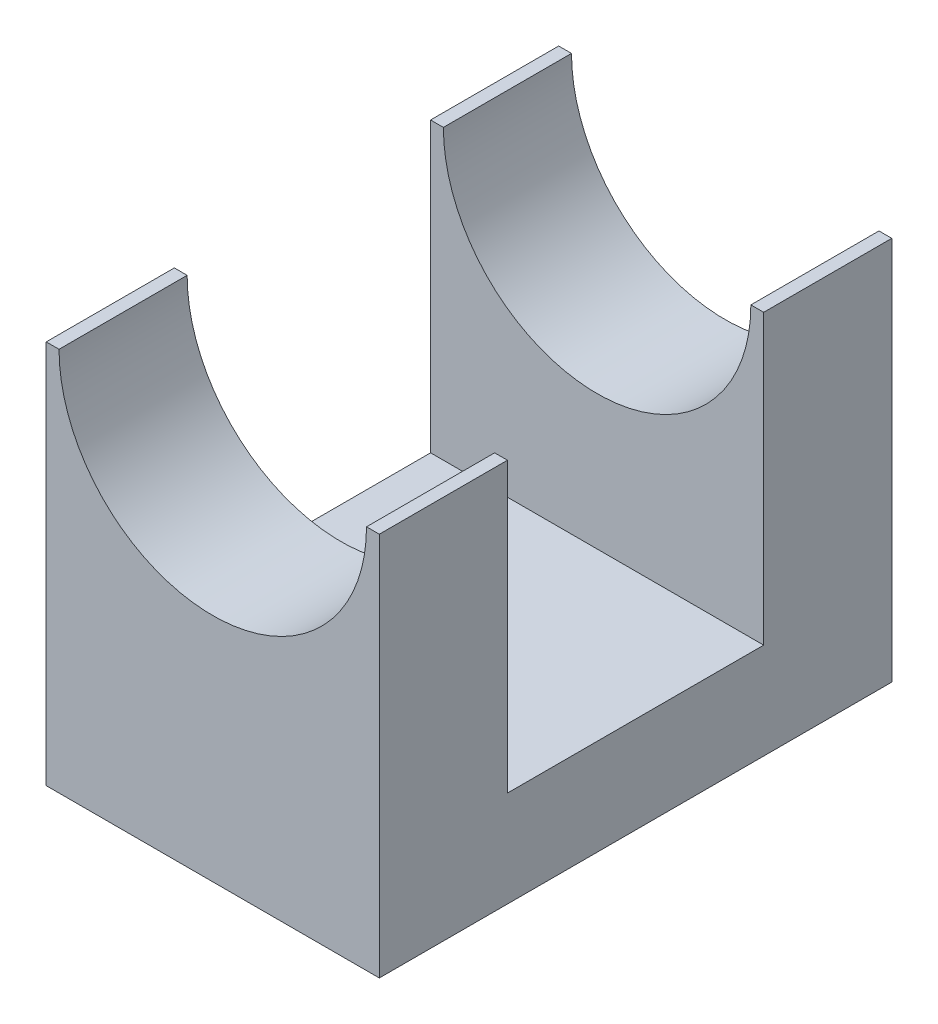
from build123d import *

# Parameters (mm, degrees)
BOSS_EXTRUDE1_DEPTH = 40
SKETCH2_W           = 104
SKETCH2_H           = 30
BOSS_EXTRUDE2_DEPTH = 80
BOSS_EXTRUDE3_START = -120
BOSS_EXTRUDE3_DEPTH = 40


with BuildPart() as part:
    # Sketch1 → Boss-Extrude1 (new body)
    with BuildSketch(Plane.XY):
        with BuildLine():
            Line((-52, 0), (-52, -120))
            Line((-52, -120), (52, -120))
            Line((52, -120), (52, 0))
            Line((52, 0), (48, 0))
            ThreePointArc((48, 0), (0, -48), (-48, 0))
            Line((-48, 0), (-52, 0))
        make_face()
    extrude(amount=BOSS_EXTRUDE1_DEPTH)

    # Sketch2 → Boss-Extrude2 (add)
    with BuildSketch(Plane(origin=(0, 0, 0), x_dir=(-1, 0, 0), z_dir=(0, 0, -1))):
        with Locations((0, -105)):
            Rectangle(SKETCH2_W, SKETCH2_H)
    extrude(amount=BOSS_EXTRUDE2_DEPTH)

    # Sketch1<2> → Boss-Extrude3 (add)
    with BuildSketch(Plane.XY.offset(BOSS_EXTRUDE3_START)):
        with BuildLine():
            Line((-52, 0), (-52, -120))
            Line((-52, -120), (52, -120))
            Line((52, -120), (52, 0))
            Line((52, 0), (48, 0))
            ThreePointArc((48, 0), (0, -48), (-48, 0))
            Line((-48, 0), (-52, 0))
        make_face()
    extrude(amount=BOSS_EXTRUDE3_DEPTH)


solid = part.part
